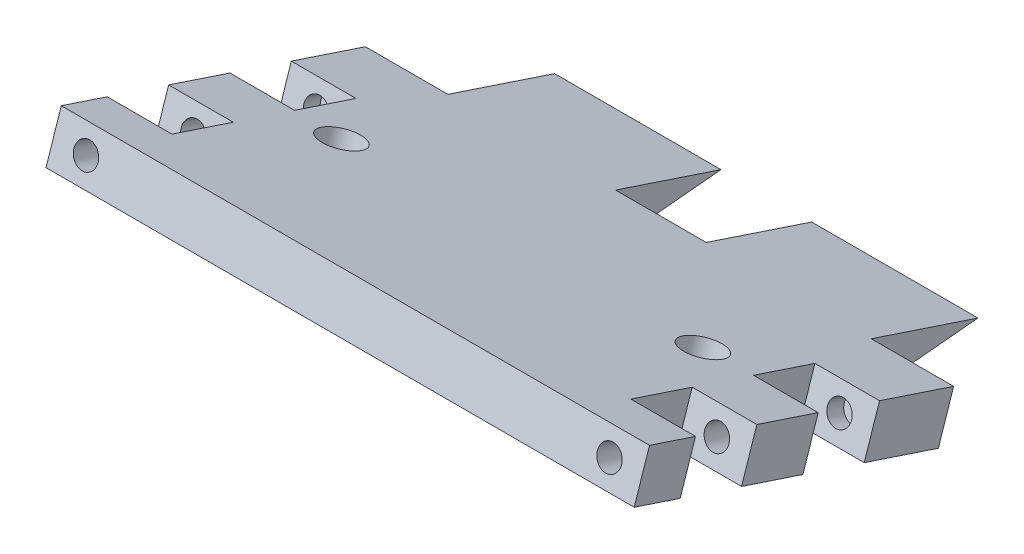
from build123d import *

# Parameters (mm, degrees)
FRAME_DEPTH     = 46.228
SKETCH20_R      = 3.175
SKETCH20_W      = 14.25884162
SKETCH20_H      = 24.127005841
SKETCH20_W_2    = 24.268036887
SKETCH20_H_2    = 24.349806062
EXTRUDE25_DEPTH = 12.7
SKETCH34_R      = 1.905
EXTRUDE26_DEPTH = 40.894


with BuildPart() as part:
    # Sketch2 → Frame (new, symmetric)
    with BuildSketch(Plane(origin=(0, 0, 0), x_dir=(0, 0, -1), z_dir=(1, 0, 0))):
        Polygon((-113.496221263, -18.267135855), (-65.375232853, -34.246135229), (-46.500539013, -32.484524644), (-111.094862411, -11.035408837), align=None)
    extrude(amount=FRAME_DEPTH, both=True)

    # Sketch20 → Extrude25 (cut)
    with BuildSketch(Plane(origin=(0, -50.397568307, 16.734957844), x_dir=(1, 0, 0), z_dir=(0, -0.9490455404212153, 0.31513895698025596))):
        with Locations(Location((-28.407237147, 74.333896504, 0), (0, 0, 270))):
            Circle(SKETCH20_R)
        with Locations(Location((28.407237147, 74.333896504, 0), (0, 0, 270))):
            Circle(SKETCH20_R)
        Polygon((54.692263435, 94.336396504), (36.068, 94.336396504), (36.068, 84.176396504), (48.857667711, 84.176396504), (48.857667711, 74.016396504), (36.068, 74.016396504), (36.068, 63.856396504), (53.624725675, 63.856396504), align=None)
        with Locations((0, 39.290078215)):
            Rectangle(SKETCH20_W, SKETCH20_H)
        with Locations((45.40546607, 39.401478325)):
            Rectangle(SKETCH20_W_2, SKETCH20_H_2)
        with Locations((-45.40546607, 39.401478325)):
            Rectangle(SKETCH20_W_2, SKETCH20_H_2)
        Polygon((-53.624725675, 63.856396504), (-54.692263435, 94.336396504), (-36.068, 94.336396504), (-36.068, 84.176396504), (-48.857667711, 84.176396504), (-48.857667711, 74.016396504), (-36.068, 74.016396504), (-36.068, 63.856396504), align=None)
    extrude(amount=-EXTRUDE25_DEPTH, mode=Mode.SUBTRACT)

    # Sketch34 → Extrude26 (cut)
    with BuildSketch(Plane(origin=(0, 32.130432452, 96.761263419), x_dir=(1, 0, 0), z_dir=(0, 0.3151389569802559, 0.9490455404212153))):
        with Locations(Location((-41.141846717, -49.29342461, 0), (0, 0, 270))):
            Circle(SKETCH34_R)
        with Locations(Location((41.141846717, -49.29342461, 0), (0, 0, 270))):
            Circle(SKETCH34_R)
    extrude(amount=-EXTRUDE26_DEPTH, mode=Mode.SUBTRACT)


solid = part.part
